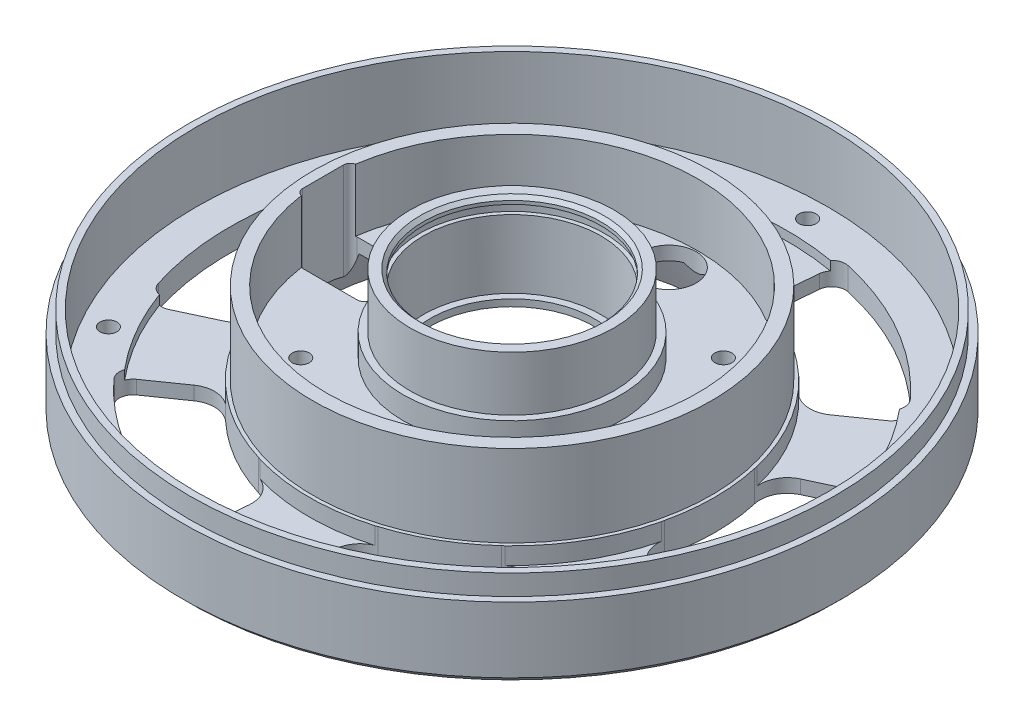
from build123d import *

# Parameters (mm, degrees)
SKETCH6_W                       = 2
SKETCH6_H                       = 9.15
SKETCH10_W                      = 1
SKETCH10_H                      = 3.3
SKETCH12_R                      = 4
CUT_EXTRUDE2_DEPTH              = 70.178717826
CIRPATTERN3_COUNT               = 4
SKETCH8_R                       = 3.5
BOSS_EXTRUDE1_DEPTH             = 3.85
M3X0_5_TAPPED_HOLE1_D           = 2.5
M3X0_5_TAPPED_HOLE3_D           = 2.5
M3X0_5_TAPPED_HOLE3_CSINK_D     = 3.5
M3X0_5_TAPPED_HOLE3_CSINK_ANGLE = 90
CIRPATTERN4_COUNT               = 6
CUT_EXTRUDE8_DEPTH              = 70.178717841
CIRPATTERN5_COUNT               = 6
SKETCH31_W                      = 8.166112118
SKETCH31_H                      = 1.3
CHAMFER1_SIZE                   = 0.5
CUT_EXTRUDE14_DEPTH             = 70.178717841
CUT_EXTRUDE14_DEPTH_BACK        = 70.178717841


with BuildPart() as part:
    # Sketch1 → Revolve1 (revolve)
    with BuildSketch(Plane.XY, mode=Mode.PRIVATE) as revolve1_sk:
        Polygon((-13.02, 8.15), (-13.02, -4.15), (-12.02, -4.15), (-12.02, -5.15), (-28.25, -5.15), (-28.25, -3.15), (-14.98, -3.15), (-14.98, 8.15), align=None)
    revolve(revolve1_sk.sketch.rotate(Axis((0, 0, 0), (0, -1, 0)), 270), axis=Axis((0, 0, 0), (0, -1, 0)))

    # Sketch4 → Revolve2 (revolve)
    with BuildSketch(Plane.XY, mode=Mode.PRIVATE) as revolve2_sk:
        Polygon((-29.75, -8.5), (-40.35, -8.5), (-40.35, -7.15), (-46.35, -7.15), (-46.35, 3), (-47.35, 3), (-47.35, 0), (-48.35, 0), (-48.35, -9.623470525), (-47.473470525, -10.5), (-28.75, -10.5), (-26.75, -5.15), (-26.75, -3.15), (-29.23, -3.15), (-29.23, -6), (-29.75, -6), align=None)
    revolve(revolve2_sk.sketch.rotate(Axis((0, 0, 0), (0, 1, 0)), 270), axis=Axis((0, 0, 0), (0, 1, 0)))

    # Sketch6 → Revolve3 (revolve)
    with BuildSketch(Plane.XY, mode=Mode.PRIVATE) as revolve3_sk:
        with Locations((-28.23, 1.425)):
            Rectangle(SKETCH6_W, SKETCH6_H)
    revolve(revolve3_sk.sketch.rotate(Axis((0, 0, 0), (0, 1, 0)), 270), axis=Axis((0, 0, 0), (0, 1, 0)))

    # Sketch7 → Revolve4 (revolve)
    with BuildSketch(Plane.XY, mode=Mode.PRIVATE) as revolve4_sk:
        Polygon((-29.58, -6), (-29.23, -6), (-29.23, -8.5), (-29.73, -8.5), (-29.73, -6.15), align=None)
    revolve(revolve4_sk.sketch.rotate(Axis((0, 0, 0), (0, 1, 0)), 270), axis=Axis((0, 0, 0), (0, 1, 0)))

    # Sketch10 → Revolve5 (revolve)
    with BuildSketch(Plane.XY, mode=Mode.PRIVATE) as revolve5_sk:
        with Locations((-15.48, -1.5)):
            Rectangle(SKETCH10_W, SKETCH10_H)
    revolve(revolve5_sk.sketch.rotate(Axis((0, 0, 0), (0, 1, 0)), 270), axis=Axis((0, 0, 0), (0, 1, 0)))

    # Sketch12 → Cut-Extrude2 (cut, through all)
    with BuildSketch(Plane(origin=(0, 0, 0), x_dir=(1, 0, 0), z_dir=(0, 1, 0))):
        with Locations(Location((-23, 0, 0), (0, 0, 270))):
            Circle(SKETCH12_R)
    cut_extrude2 = extrude(amount=-CUT_EXTRUDE2_DEPTH, mode=Mode.SUBTRACT)

    # CirPattern3: Cut-Extrude2 ×4 about axis
    cirpattern3_axis = Axis((0, 0, 0), (0, 1, 0))
    for i in range(1, CIRPATTERN3_COUNT):
        add(cut_extrude2.rotate(cirpattern3_axis, i * 360 / CIRPATTERN3_COUNT), mode=Mode.SUBTRACT)

    # Sketch8 → Boss-Extrude1 (add)
    with BuildSketch(Plane.XZ.offset(5.15)):
        with Locations(Location((-15.5, 15.5, 0), (0, 0, 90))):
            Circle(SKETCH8_R)
        with Locations(Location((15.5, 15.5, 0), (0, 0, 90))):
            Circle(SKETCH8_R)
        with Locations(Location((15.5, -15.5, 0), (0, 0, 90))):
            Circle(SKETCH8_R)
        with Locations(Location((-15.5, -15.5, 0), (0, 0, 90))):
            Circle(SKETCH8_R)
    extrude(amount=BOSS_EXTRUDE1_DEPTH)

    # M3x0.5 Tapped Hole1 (through all)
    with Locations(Plane(origin=(0, -9, 0), x_dir=(-1, 0, 0), z_dir=(0, -1, 0))):
        with Locations((-15.5, 15.5), (15.5, 15.5), (15.5, -15.5), (-15.5, -15.5)):
            Hole(M3X0_5_TAPPED_HOLE1_D / 2)

    # M3x0.5 Tapped Hole3 (through all)
    with Locations(Plane(origin=(0, -10.5, 0), x_dir=(-1, 0, 0), z_dir=(0, -1, 0))):
        with Locations((0, 43.35)):
            m3x0_5_tapped_hole3 = CounterSinkHole(M3X0_5_TAPPED_HOLE3_D / 2, M3X0_5_TAPPED_HOLE3_CSINK_D / 2, counter_sink_angle=M3X0_5_TAPPED_HOLE3_CSINK_ANGLE)

    # CirPattern4: M3x0.5 Tapped Hole3 ×6 about axis
    cirpattern4_axis = Axis((0, 0, 0), (0, 1, 0))
    for i in range(1, CIRPATTERN4_COUNT):
        add(m3x0_5_tapped_hole3.rotate(cirpattern4_axis, i * 360 / CIRPATTERN4_COUNT), mode=Mode.SUBTRACT)

    # Sketch26 → Cut-Extrude8 (cut, symmetric)
    with BuildSketch(Plane(origin=(0, 0, 0), x_dir=(1, 0, 0), z_dir=(0, 1, 0))):
        with BuildLine():
            Line((31.195130186, 11.125231148), (36.672756326, 13.679490166))
            ThreePointArc((36.672756326, 13.679490166), (38.322654307, 13.697863378), (39.424879398, 12.470019425))
            ThreePointArc((39.424879398, 12.470019425), (41.35, 0), (39.424879398, -12.470019425))
            ThreePointArc((39.424879398, -12.470019425), (38.322654307, -13.697863378), (36.672756326, -13.679490166))
            Line((36.672756326, -13.679490166), (31.195130186, -11.125231148))
            ThreePointArc((31.195130186, -11.125231148), (29.292766374, -9.258272818), (28.985739227, -6.61058405))
            ThreePointArc((28.985739227, -6.61058405), (29.73, 0), (28.985739227, 6.61058405))
            ThreePointArc((28.985739227, 6.61058405), (29.292766374, 9.258272818), (31.195130186, 11.125231148))
        make_face()
    cut_extrude8 = extrude(amount=CUT_EXTRUDE8_DEPTH, both=True, mode=Mode.SUBTRACT)

    # CirPattern5: Cut-Extrude8 ×6 about axis
    cirpattern5_axis = Axis((0, 0, 0), (0, 1, 0))
    for i in range(1, CIRPATTERN5_COUNT):
        add(cut_extrude8.rotate(cirpattern5_axis, i * 360 / CIRPATTERN5_COUNT), mode=Mode.SUBTRACT)

    # Sketch31 → Cut-Revolve1 (revolve, cut)
    with BuildSketch(Plane.XY, mode=Mode.PRIVATE) as cut_revolve1_sk:
        with Locations((-9.516943941, 6.5)):
            Rectangle(SKETCH31_W, SKETCH31_H)
    revolve(cut_revolve1_sk.sketch.rotate(Axis((0, 0, 0), (0, -1, 0)), 270), axis=Axis((0, 0, 0), (0, -1, 0)), mode=Mode.SUBTRACT)

    # Chamfer1
    chamfer1_edges = [part.edges().sort_by_distance(p)[0] for p in [
        (0, 8.15, -13.02),
    ]]
    chamfer(chamfer1_edges, length=CHAMFER1_SIZE)

    # Sketch32 → Cut-Extrude14 (cut, two sides: drawn at the far end of the back side and taken through both)
    with BuildSketch(Plane(origin=(0, 0, 0), x_dir=(1, 0, 0), z_dir=(0, 1, 0)).offset(-CUT_EXTRUDE14_DEPTH_BACK)):
        with BuildLine():
            Line((-18.73, 4), (-26.73, 4))
            ThreePointArc((-26.73, 4), (-27.437106781, 3.707106781), (-27.73, 3))
            Line((-27.73, 3), (-27.73, -3))
            ThreePointArc((-27.73, -3), (-27.437106781, -3.707106781), (-26.73, -4))
            Line((-26.73, -4), (-18.73, -4))
            ThreePointArc((-18.73, -4), (-18.022893219, -3.707106781), (-17.73, -3))
            Line((-17.73, -3), (-17.73, 3))
            ThreePointArc((-17.73, 3), (-18.022893219, 3.707106781), (-18.73, 4))
        make_face()
    extrude(amount=CUT_EXTRUDE14_DEPTH + CUT_EXTRUDE14_DEPTH_BACK, mode=Mode.SUBTRACT)


solid = part.part
